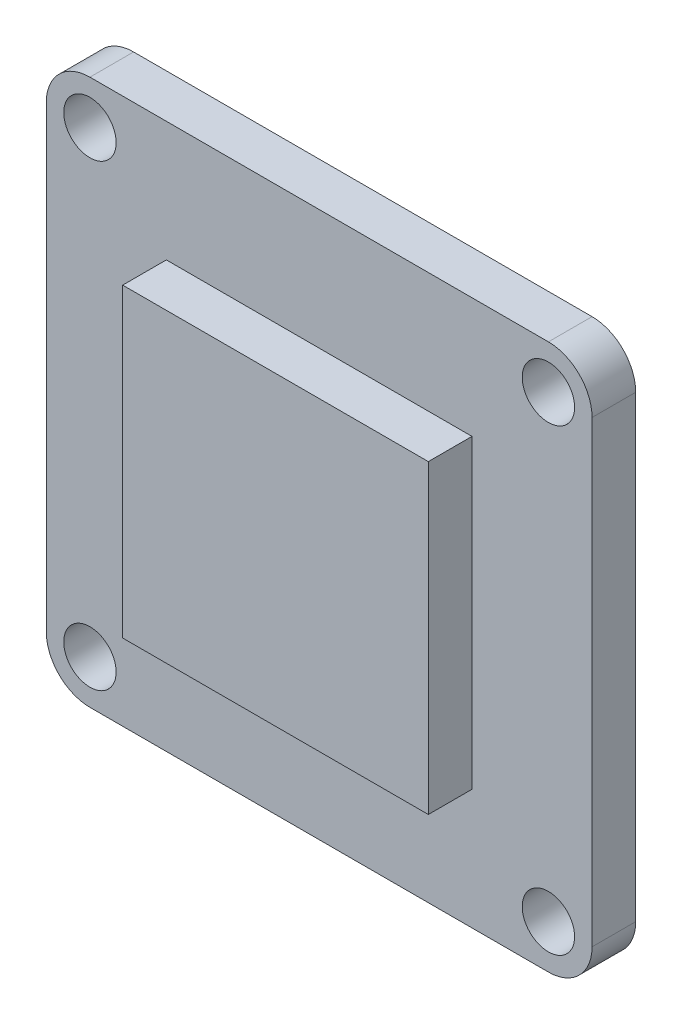
from build123d import *

# Parameters (mm, degrees)
SKETCH1_R           = 1.2
BOSS_EXTRUDE1_DEPTH = 2
SKETCH2_W           = 14
SKETCH2_H           = 14
BOSS_EXTRUDE2_DEPTH = 2


with BuildPart() as part:
    # Sketch1 → Boss-Extrude1 (new body)
    with BuildSketch(Plane.XY):
        with BuildLine():
            Line((58.085871194, -29), (79.085871194, -29))
            ThreePointArc((79.085871194, -29), (80.500084756, -29.585786438), (81.085871194, -31))
            Line((81.085871194, -31), (81.085871194, -52))
            ThreePointArc((81.085871194, -52), (80.500084756, -53.414213562), (79.085871194, -54))
            Line((79.085871194, -54), (58.085871194, -54))
            ThreePointArc((58.085871194, -54), (56.671657631, -53.414213562), (56.085871194, -52))
            Line((56.085871194, -52), (56.085871194, -31))
            ThreePointArc((56.085871194, -31), (56.671657631, -29.585786438), (58.085871194, -29))
        make_face()
        with Locations((58.085871194, -52)):
            Circle(SKETCH1_R, mode=Mode.SUBTRACT)
        with Locations((79.085871194, -52)):
            Circle(SKETCH1_R, mode=Mode.SUBTRACT)
        with Locations((79.085871194, -31)):
            Circle(SKETCH1_R, mode=Mode.SUBTRACT)
        with Locations((58.085871194, -31)):
            Circle(SKETCH1_R, mode=Mode.SUBTRACT)
    extrude(amount=BOSS_EXTRUDE1_DEPTH)

    # Sketch2 → Boss-Extrude2 (add)
    with BuildSketch(Plane.XY.offset(2)):
        with Locations((68.585871194, -41.5)):
            Rectangle(SKETCH2_W, SKETCH2_H)
    extrude(amount=BOSS_EXTRUDE2_DEPTH)


solid = part.part
